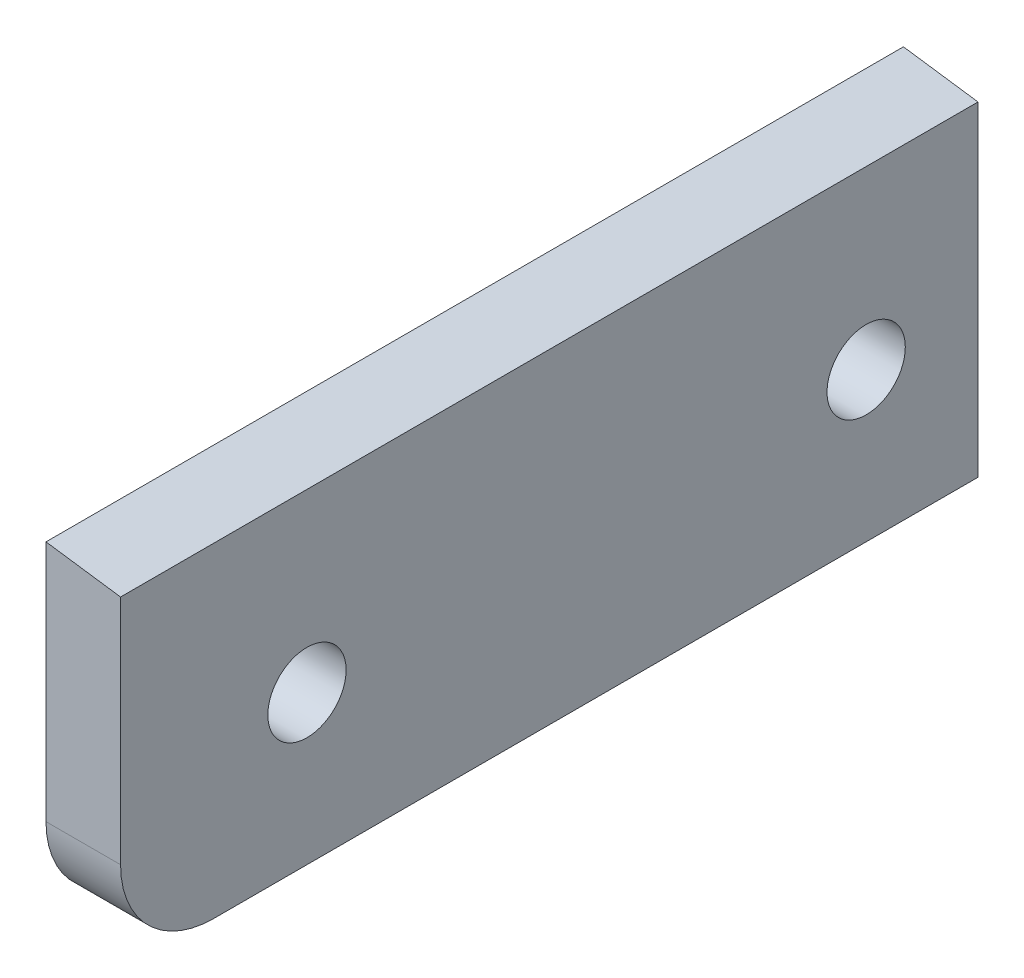
from build123d import *

# Parameters (mm, degrees)
EXTRUSION1_DEPTH  = 46
CONG_1_R          = 5
TROU_TARAUD_M51_D = 4.2


with BuildPart() as part:
    # Esquisse1 → Extrusion1 (new body)
    with BuildSketch(Plane.XY):
        Polygon((0, 0), (4, 0), (4, 17.437836661), (0, 18), align=None)
    extrude(amount=EXTRUSION1_DEPTH)

    # Congé1
    cong_1_edges = [part.edges().sort_by_distance(p)[0] for p in [
        (2, 0, 46),
    ]]
    fillet(cong_1_edges, radius=CONG_1_R)

    # Trou taraudé M51 (through all)
    with Locations(Plane(origin=(4, 0, 0), x_dir=(0, 0, -1), z_dir=(1, 0, 0))):
        with Locations((-6, 8), (-36, 8)):
            Hole(TROU_TARAUD_M51_D / 2)


solid = part.part
